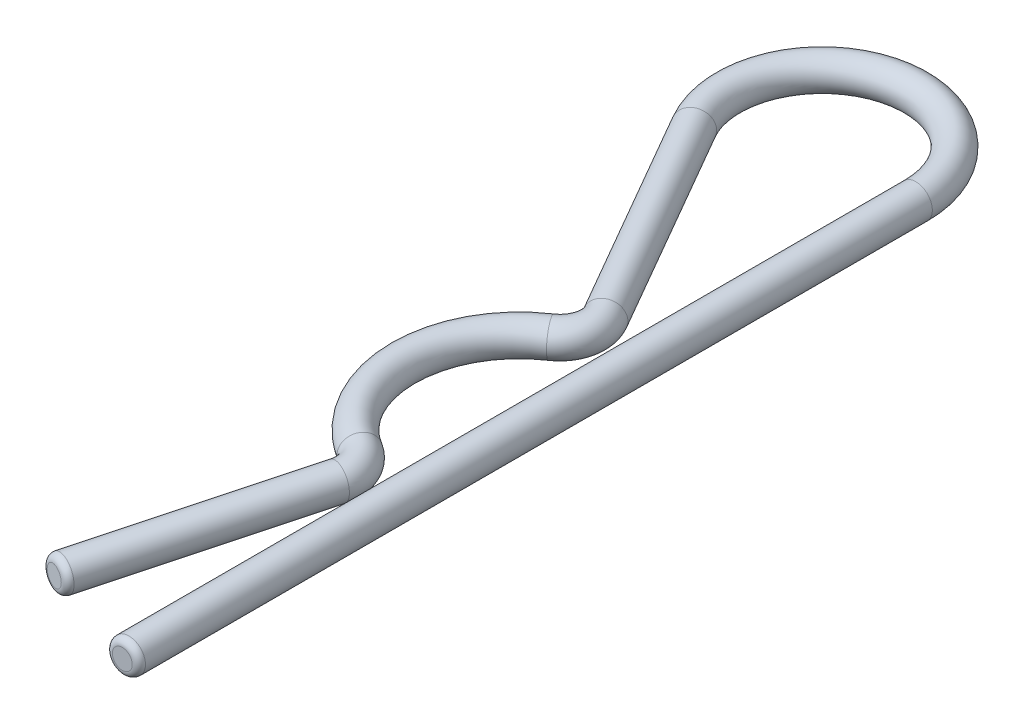
from build123d import *

# Parameters (mm, degrees)
SKETCH2_R = 2.5
FILLET1_R = 1


with BuildPart() as part:
    # Sweep2: sweep along a path in Sketch1
    with BuildLine(Plane(origin=(0, 0, 0), x_dir=(1, 0, 0), z_dir=(0, 1, 0))) as sweep2_path:
        Line((0, -60), (0, 60))
        ThreePointArc((0, 60), (-17.83774349, 73.691126094), (-26.451096024, 52.919939689))
        Line((-26.451096024, 52.919939689), (-8.164818455, 21.208493014))
        ThreePointArc((-8.164818455, 21.208493014), (-7.627304585, 17.573584756), (-9.719317887, 14.552829959))
        ThreePointArc((-9.719317887, 14.552829959), (-17.497154023, -0.31559641), (-9.188187443, -14.893864895))
        ThreePointArc((-9.188187443, -14.893864895), (-7.166578236, -17.303395297), (-6.983754723, -20.443350091))
        Line((-6.983754723, -20.443350091), (-16.042421302, -54.250754011))
    # Sketch2 → Sweep2 (sweep)
    with BuildSketch(Plane(origin=(0, 0, 60), x_dir=(-1, 0, 0), z_dir=(0, 0, -1))):
        Circle(SKETCH2_R)
    sweep(path=sweep2_path.line)

    # Fillet1
    fillet1_edges = [part.edges().sort_by_distance(p)[0] for p in [
        (-18.457235868, 0, 53.603706398),
        (2.5, 0, 60),
    ]]
    fillet(fillet1_edges, radius=FILLET1_R)


solid = part.part
